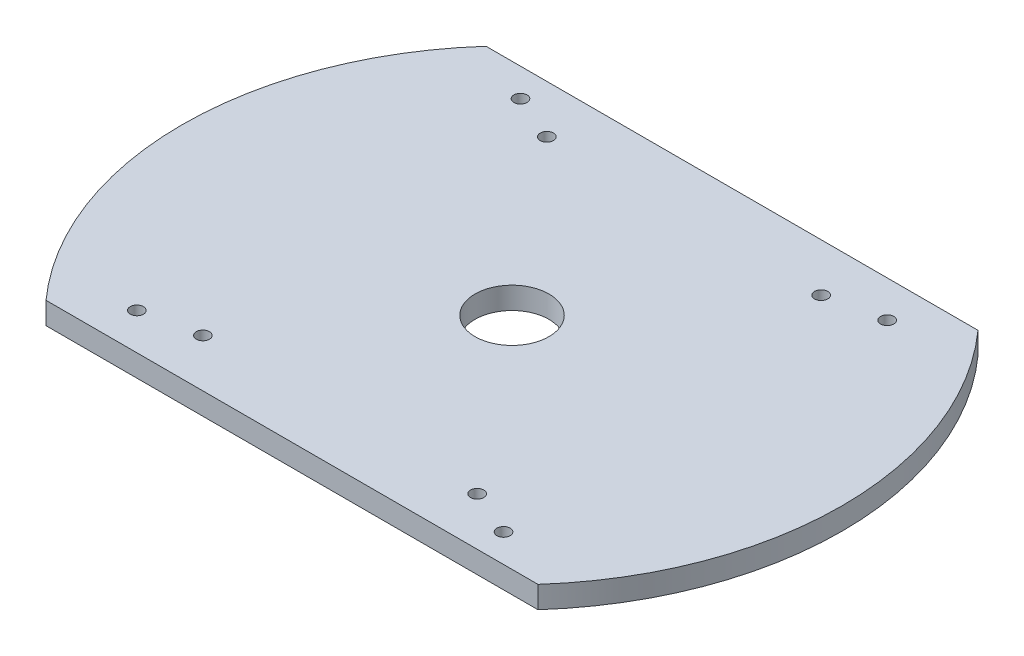
from build123d import *

# Parameters (mm, degrees)
SKETCH1_R           = 75
SKETCH1_R_2         = 1.5
SKETCH1_R_3         = 8.4
BOSS_EXTRUDE1_DEPTH = 5
CUT_EXTRUDE1_START  = -10
CUT_EXTRUDE1_DEPTH  = 10


with BuildPart() as part:
    # Sketch1 → Boss-Extrude1 (new body)
    with BuildSketch(Plane(origin=(0, 0, 0), x_dir=(1, 0, 0), z_dir=(0, 1, 0))):
        with Locations(Location((0, 0, 0), (0, 0, 270))):
            Circle(SKETCH1_R)
        with Locations(Location((-41.664692583, 43.590634223, 0), (0, 0, 270))):
            Circle(SKETCH1_R_2, mode=Mode.SUBTRACT)
        with Locations(Location((43.590634223, 41.664692583, 0), (0, 0, 270))):
            Circle(SKETCH1_R_2, mode=Mode.SUBTRACT)
        with Locations(Location((41.664692583, -43.590634223, 0), (0, 0, 270))):
            Circle(SKETCH1_R_2, mode=Mode.SUBTRACT)
        with Locations(Location((-43.590634223, -41.664692583, 0), (0, 0, 270))):
            Circle(SKETCH1_R_2, mode=Mode.SUBTRACT)
        with Locations(Location((-31.164692583, 39.090634223, 0), (0, 0, 270))):
            Circle(SKETCH1_R_2, mode=Mode.SUBTRACT)
        with Locations(Location((0, 0, 0), (0, 0, 270))):
            Circle(SKETCH1_R_3, mode=Mode.SUBTRACT)
        with Locations(Location((31.164692583, 39.090634223, 0), (0, 0, 270))):
            Circle(SKETCH1_R_2, mode=Mode.SUBTRACT)
        with Locations(Location((31.164692583, -39.090634223, 0), (0, 0, 270))):
            Circle(SKETCH1_R_2, mode=Mode.SUBTRACT)
        with Locations(Location((-31.164692583, -39.090634223, 0), (0, 0, 270))):
            Circle(SKETCH1_R_2, mode=Mode.SUBTRACT)
    extrude(amount=BOSS_EXTRUDE1_DEPTH)

    # Sketch3 → Cut-Extrude1 (cut)
    with BuildSketch(Plane(origin=(0, 5, 0), x_dir=(1, 0, 0), z_dir=(0, 1, 0)).offset(CUT_EXTRUDE1_START)):
        with BuildLine():
            Line((-55.901699437, 50), (0, 50))
            Line((0, 50), (55.901699437, 50))
            ThreePointArc((55.901699437, 50), (0, 75), (-55.901699437, 50))
        make_face()
        with BuildLine():
            Line((55.901699437, -50), (0, -50))
            Line((0, -50), (-55.901699437, -50))
            ThreePointArc((-55.901699437, -50), (0, -75), (55.901699437, -50))
        make_face()
    extrude(amount=CUT_EXTRUDE1_DEPTH, mode=Mode.SUBTRACT)


solid = part.part
